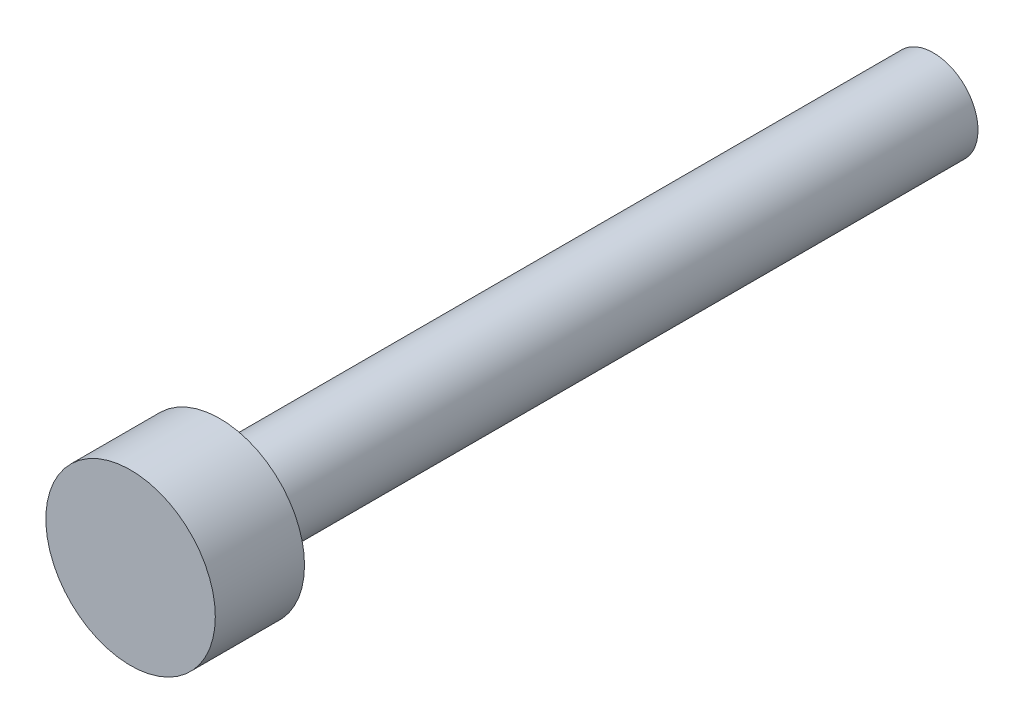
from build123d import *

# Parameters (mm, degrees)
NOMINAL_SHANK_START    = -16
SKETCH_NOMINAL_SHANK_R = 1
NOMINAL_SHANK_DEPTH    = 16
SKETCH_HEAD_R          = 1.9
HEAD_DEPTH             = 2


with BuildPart() as part:
    # Sketch_Nominal_shank → Nominal_shank (new body)
    with BuildSketch(Plane.XY.offset(NOMINAL_SHANK_START)):
        Circle(SKETCH_NOMINAL_SHANK_R)
    extrude(amount=NOMINAL_SHANK_DEPTH)

    # Sketch_Head → Head (add)
    with BuildSketch(Plane.XY):
        Circle(SKETCH_HEAD_R)
    extrude(amount=HEAD_DEPTH)


solid = part.part
